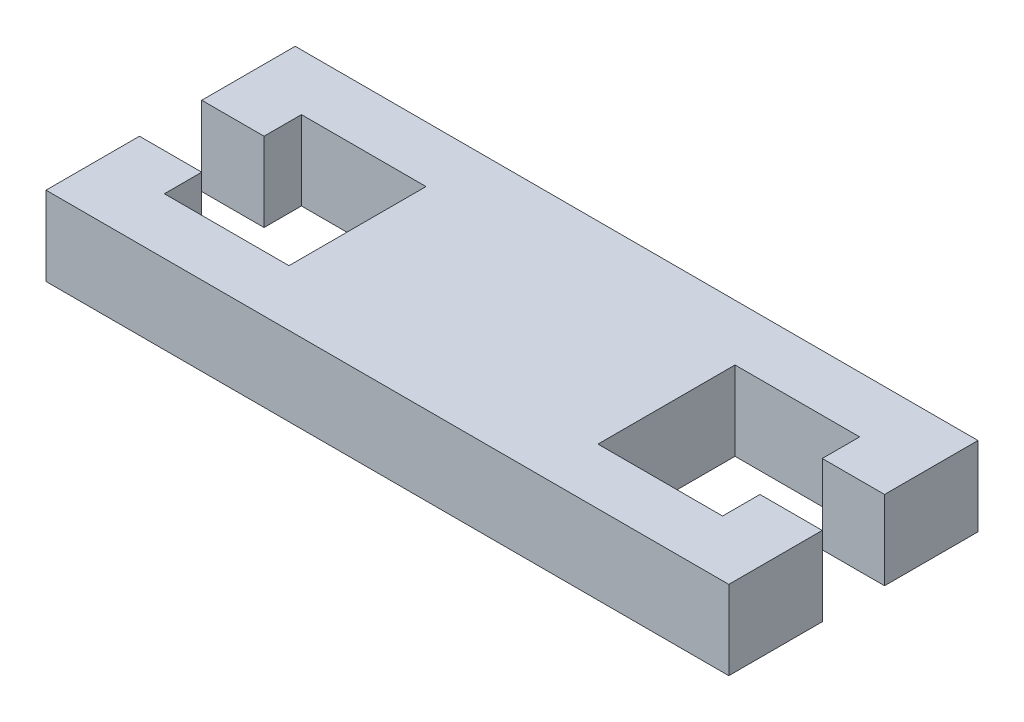
from build123d import *

# Parameters (mm, degrees)
BOSS_EXTRUDE1_DEPTH = 6.35


with BuildPart() as part:
    # Sketch1 → Boss-Extrude1 (new body)
    with BuildSketch(Plane(origin=(0, 0, 0), x_dir=(1, 0, 0), z_dir=(0, 1, 0))):
        Polygon((0, 7.5), (5, 7.5), (5, 4.5), (15, 4.5), (15, 15.5), (5, 15.5), (5, 12.5), (0, 12.5), (0, 20), (54.8, 20), (54.8, 12.5), (49.8, 12.5), (49.8, 15.5), (39.8, 15.5), (39.8, 4.5), (49.8, 4.5), (49.8, 7.5), (54.8, 7.5), (54.8, 0), (0, 0), align=None)
    extrude(amount=BOSS_EXTRUDE1_DEPTH)


solid = part.part
